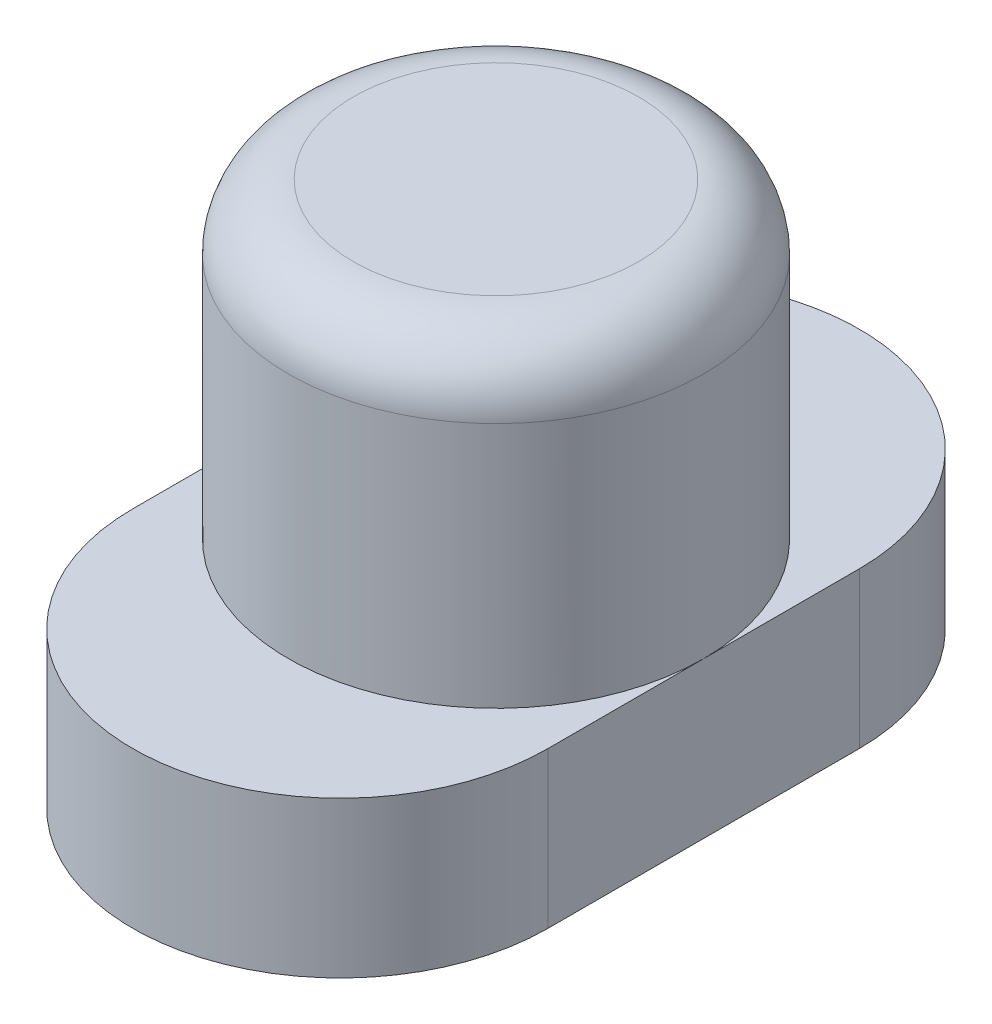
from build123d import *

# Parameters (mm, degrees)
SKETCH2_W          = 3.5
SKETCH2_H          = 2.5
CUT_EXTRUDE1_DEPTH = 3.5
FILLET1_R          = 1.25
CUT_EXTRUDE2_DEPTH = 14.37908816


with BuildPart() as part:
    # Sketch1 → Revolve1 (revolve)
    with BuildSketch(Plane.XY, mode=Mode.PRIVATE) as revolve1_sk:
        Polygon((0, 9), (4, 9), (4, 3), (7, 3), (7, 0), (0, 0), align=None)
    revolve(revolve1_sk.sketch.rotate(Axis((0, 9, 0), (0, -1, 0)), 180), axis=Axis((0, 9, 0), (0, -1, 0)))

    # Sketch2 → Cut-Extrude1 (cut)
    with BuildSketch(Plane.XZ):
        Rectangle(SKETCH2_W, SKETCH2_H)
    extrude(amount=-CUT_EXTRUDE1_DEPTH, mode=Mode.SUBTRACT)

    # Fillet1
    fillet1_edges = [part.edges().sort_by_distance(p)[0] for p in [
        (4, 9, 0),
    ]]
    fillet(fillet1_edges, radius=FILLET1_R)

    # Sketch3 → Cut-Extrude2 (cut, through all)
    with BuildSketch(Plane(origin=(0, 0, 0), x_dir=(1, 0, 0), z_dir=(0, 1, 0))):
        with BuildLine():
            Line((-14, -3), (-14, 3))
            ThreePointArc((-14, 3), (0, 17), (14, 3))
            Line((14, 3), (14, -3))
            ThreePointArc((14, -3), (0, -17), (-14, -3))
        make_face()
        with BuildLine():
            Line((-4, -3), (-4, 3))
            ThreePointArc((-4, 3), (0, 7), (4, 3))
            Line((4, 3), (4, -3))
            ThreePointArc((4, -3), (0, -7), (-4, -3))
        make_face(mode=Mode.SUBTRACT)
    extrude(amount=CUT_EXTRUDE2_DEPTH, mode=Mode.SUBTRACT)


solid = part.part
